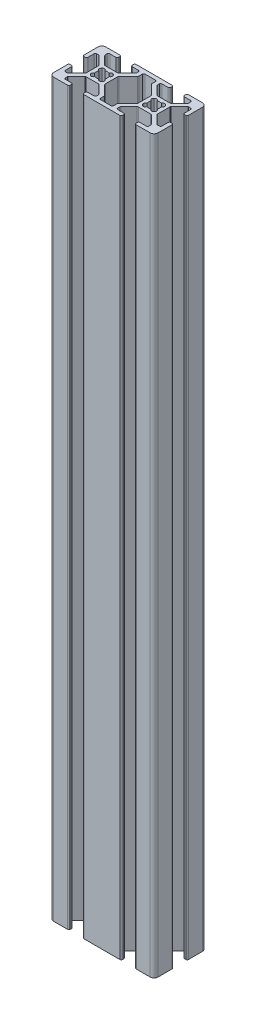
from build123d import *

# Parameters (mm, degrees)
EXTRUDE_1_DEPTH = 140


with BuildPart() as part:
    # 草图1 → 凸台-拉伸1 (new, symmetric)
    with BuildSketch(Plane(origin=(0, 0, 0), x_dir=(1, 0, 0), z_dir=(0, 1, 0))):
        with BuildLine():
            Line((-3.011929568, 5.856870214), (1.755909109, 5.856870214))
            ThreePointArc((1.755909109, 5.856870214), (1.950312292, 5.818201017), (2.115119353, 5.708080459))
            Line((2.115119353, 5.708080459), (5.218200015, 2.604999798))
            ThreePointArc((5.218200015, 2.604999798), (5.328320573, 2.440192737), (5.36698977, 2.245789553))
            Line((5.36698977, 2.245789553), (5.36698977, 1.519870214))
            ThreePointArc((5.36698977, 1.519870214), (5.218200015, 1.16065997), (4.85898977, 1.011870214))
            Line((4.85898977, 1.011870214), (2.50998977, 1.011870214))
            ThreePointArc((2.50998977, 1.011870214), (2.150779525, 0.863080459), (2.00198977, 0.503870214))
            Line((2.00198977, 0.503870214), (2.00198977, 0.019870214))
            ThreePointArc((2.00198977, 0.019870214), (2.150779525, -0.33934003), (2.50998977, -0.488129786))
            Line((2.50998977, -0.488129786), (16.23398977, -0.488129786))
            ThreePointArc((16.23398977, -0.488129786), (16.593200015, -0.33934003), (16.74198977, 0.019870214))
            Line((16.74198977, 0.019870214), (16.74198977, 0.503870214))
            ThreePointArc((16.74198977, 0.503870214), (16.593200015, 0.863080459), (16.23398977, 1.011870214))
            Line((16.23398977, 1.011870214), (13.88498977, 1.011870214))
            ThreePointArc((13.88498977, 1.011870214), (13.525779525, 1.16065997), (13.37698977, 1.519870214))
            Line((13.37698977, 1.519870214), (13.37698977, 2.245789553))
            ThreePointArc((13.37698977, 2.245789553), (13.415658968, 2.440192737), (13.525779525, 2.604999798))
            Line((13.525779525, 2.604999798), (16.628860187, 5.708080459))
            ThreePointArc((16.628860187, 5.708080459), (16.793667248, 5.818201017), (16.988070432, 5.856870214))
            Line((16.988070432, 5.856870214), (21.755909109, 5.856870214))
            ThreePointArc((21.755909109, 5.856870214), (21.950312292, 5.818201017), (22.115119353, 5.708080459))
            Line((22.115119353, 5.708080459), (25.218200015, 2.604999798))
            ThreePointArc((25.218200015, 2.604999798), (25.328320573, 2.440192737), (25.36698977, 2.245789553))
            Line((25.36698977, 2.245789553), (25.36698977, 1.519870214))
            ThreePointArc((25.36698977, 1.519870214), (25.218200015, 1.16065997), (24.85898977, 1.011870214))
            Line((24.85898977, 1.011870214), (22.50998977, 1.011870214))
            ThreePointArc((22.50998977, 1.011870214), (22.150779525, 0.863080459), (22.00198977, 0.503870214))
            Line((22.00198977, 0.503870214), (22.00198977, 0.019870214))
            ThreePointArc((22.00198977, 0.019870214), (22.150779525, -0.33934003), (22.50998977, -0.488129786))
            Line((22.50998977, -0.488129786), (27.87198977, -0.488129786))
            ThreePointArc((27.87198977, -0.488129786), (28.932649942, -0.048789957), (29.37198977, 1.011870214))
            Line((29.37198977, 1.011870214), (29.37198977, 6.373870214))
            ThreePointArc((29.37198977, 6.373870214), (29.223200015, 6.733080459), (28.86398977, 6.881870214))
            Line((28.86398977, 6.881870214), (28.37998977, 6.881870214))
            ThreePointArc((28.37998977, 6.881870214), (28.020779525, 6.733080459), (27.87198977, 6.373870214))
            Line((27.87198977, 6.373870214), (27.87198977, 4.024870214))
            ThreePointArc((27.87198977, 4.024870214), (27.723200015, 3.66565997), (27.36398977, 3.516870214))
            Line((27.36398977, 3.516870214), (26.638070432, 3.516870214))
            ThreePointArc((26.638070432, 3.516870214), (26.443667248, 3.555539412), (26.278860187, 3.66565997))
            Line((26.278860187, 3.66565997), (23.175779525, 6.768740631))
            ThreePointArc((23.175779525, 6.768740631), (23.065658968, 6.933547692), (23.02698977, 7.127950876))
            Line((23.02698977, 7.127950876), (23.02698977, 11.895789553))
            ThreePointArc((23.02698977, 11.895789553), (23.065658968, 12.090192737), (23.175779525, 12.254999798))
            Line((23.175779525, 12.254999798), (26.278860187, 15.358080459))
            ThreePointArc((26.278860187, 15.358080459), (26.443667248, 15.468201017), (26.638070432, 15.506870214))
            Line((26.638070432, 15.506870214), (27.36398977, 15.506870214))
            ThreePointArc((27.36398977, 15.506870214), (27.723200015, 15.358080459), (27.87198977, 14.998870214))
            Line((27.87198977, 14.998870214), (27.87198977, 12.649870214))
            ThreePointArc((27.87198977, 12.649870214), (28.020779525, 12.29065997), (28.37998977, 12.141870214))
            Line((28.37998977, 12.141870214), (28.86398977, 12.141870214))
            ThreePointArc((28.86398977, 12.141870214), (29.223200015, 12.29065997), (29.37198977, 12.649870214))
            Line((29.37198977, 12.649870214), (29.37198977, 18.011870214))
            ThreePointArc((29.37198977, 18.011870214), (28.932649942, 19.072530386), (27.87198977, 19.511870214))
            Line((27.87198977, 19.511870214), (22.50998977, 19.511870214))
            ThreePointArc((22.50998977, 19.511870214), (22.150779525, 19.363080459), (22.00198977, 19.003870214))
            Line((22.00198977, 19.003870214), (22.00198977, 18.519870214))
            ThreePointArc((22.00198977, 18.519870214), (22.150779525, 18.16065997), (22.50998977, 18.011870214))
            Line((22.50998977, 18.011870214), (24.85898977, 18.011870214))
            ThreePointArc((24.85898977, 18.011870214), (25.218200015, 17.863080459), (25.36698977, 17.503870214))
            Line((25.36698977, 17.503870214), (25.36698977, 16.777950876))
            ThreePointArc((25.36698977, 16.777950876), (25.328320573, 16.583547692), (25.218200015, 16.418740631))
            Line((25.218200015, 16.418740631), (22.115119353, 13.31565997))
            ThreePointArc((22.115119353, 13.31565997), (21.950312292, 13.205539412), (21.755909109, 13.166870214))
            Line((21.755909109, 13.166870214), (16.988070432, 13.166870214))
            ThreePointArc((16.988070432, 13.166870214), (16.793667248, 13.205539412), (16.628860187, 13.31565997))
            Line((16.628860187, 13.31565997), (13.525779525, 16.418740631))
            ThreePointArc((13.525779525, 16.418740631), (13.415658968, 16.583547692), (13.37698977, 16.777950876))
            Line((13.37698977, 16.777950876), (13.37698977, 17.503870214))
            ThreePointArc((13.37698977, 17.503870214), (13.525779525, 17.863080459), (13.88498977, 18.011870214))
            Line((13.88498977, 18.011870214), (16.23398977, 18.011870214))
            ThreePointArc((16.23398977, 18.011870214), (16.593200015, 18.16065997), (16.74198977, 18.519870214))
            Line((16.74198977, 18.519870214), (16.74198977, 19.003870214))
            ThreePointArc((16.74198977, 19.003870214), (16.593200015, 19.363080459), (16.23398977, 19.511870214))
            Line((16.23398977, 19.511870214), (2.50998977, 19.511870214))
            ThreePointArc((2.50998977, 19.511870214), (2.150779525, 19.363080459), (2.00198977, 19.003870214))
            Line((2.00198977, 19.003870214), (2.00198977, 18.519870214))
            ThreePointArc((2.00198977, 18.519870214), (2.150779525, 18.16065997), (2.50998977, 18.011870214))
            Line((2.50998977, 18.011870214), (4.85898977, 18.011870214))
            ThreePointArc((4.85898977, 18.011870214), (5.218200015, 17.863080459), (5.36698977, 17.503870214))
            Line((5.36698977, 17.503870214), (5.36698977, 16.777950876))
            ThreePointArc((5.36698977, 16.777950876), (5.328320573, 16.583547692), (5.218200015, 16.418740631))
            Line((5.218200015, 16.418740631), (2.115119353, 13.31565997))
            ThreePointArc((2.115119353, 13.31565997), (1.950312292, 13.205539412), (1.755909109, 13.166870214))
            Line((1.755909109, 13.166870214), (-3.011929568, 13.166870214))
            ThreePointArc((-3.011929568, 13.166870214), (-3.206332752, 13.205539412), (-3.371139813, 13.31565997))
            Line((-3.371139813, 13.31565997), (-6.474220475, 16.418740631))
            ThreePointArc((-6.474220475, 16.418740631), (-6.584341032, 16.583547692), (-6.62301023, 16.777950876))
            Line((-6.62301023, 16.777950876), (-6.62301023, 17.503870214))
            ThreePointArc((-6.62301023, 17.503870214), (-6.474220475, 17.863080459), (-6.11501023, 18.011870214))
            Line((-6.11501023, 18.011870214), (-3.76601023, 18.011870214))
            ThreePointArc((-3.76601023, 18.011870214), (-3.406799985, 18.16065997), (-3.25801023, 18.519870214))
            Line((-3.25801023, 18.519870214), (-3.25801023, 19.003870214))
            ThreePointArc((-3.25801023, 19.003870214), (-3.406799985, 19.363080459), (-3.76601023, 19.511870214))
            Line((-3.76601023, 19.511870214), (-9.12801023, 19.511870214))
            ThreePointArc((-9.12801023, 19.511870214), (-10.188670402, 19.072530386), (-10.62801023, 18.011870214))
            Line((-10.62801023, 18.011870214), (-10.62801023, 12.649870214))
            ThreePointArc((-10.62801023, 12.649870214), (-10.479220475, 12.29065997), (-10.12001023, 12.141870214))
            Line((-10.12001023, 12.141870214), (-9.63601023, 12.141870214))
            ThreePointArc((-9.63601023, 12.141870214), (-9.276799985, 12.29065997), (-9.12801023, 12.649870214))
            Line((-9.12801023, 12.649870214), (-9.12801023, 14.998870214))
            ThreePointArc((-9.12801023, 14.998870214), (-8.979220475, 15.358080459), (-8.62001023, 15.506870214))
            Line((-8.62001023, 15.506870214), (-7.894090891, 15.506870214))
            ThreePointArc((-7.894090891, 15.506870214), (-7.699687708, 15.468201017), (-7.534880647, 15.358080459))
            Line((-7.534880647, 15.358080459), (-4.431799985, 12.254999798))
            ThreePointArc((-4.431799985, 12.254999798), (-4.321679427, 12.090192737), (-4.28301023, 11.895789553))
            Line((-4.28301023, 11.895789553), (-4.28301023, 7.127950876))
            ThreePointArc((-4.28301023, 7.127950876), (-4.321679427, 6.933547692), (-4.431799985, 6.768740631))
            Line((-4.431799985, 6.768740631), (-7.534880647, 3.66565997))
            ThreePointArc((-7.534880647, 3.66565997), (-7.699687708, 3.555539412), (-7.894090891, 3.516870214))
            Line((-7.894090891, 3.516870214), (-8.62001023, 3.516870214))
            ThreePointArc((-8.62001023, 3.516870214), (-8.979220475, 3.66565997), (-9.12801023, 4.024870214))
            Line((-9.12801023, 4.024870214), (-9.12801023, 6.373870214))
            ThreePointArc((-9.12801023, 6.373870214), (-9.276799985, 6.733080459), (-9.63601023, 6.881870214))
            Line((-9.63601023, 6.881870214), (-10.12001023, 6.881870214))
            ThreePointArc((-10.12001023, 6.881870214), (-10.479220475, 6.733080459), (-10.62801023, 6.373870214))
            Line((-10.62801023, 6.373870214), (-10.62801023, 1.011870214))
            ThreePointArc((-10.62801023, 1.011870214), (-10.188670402, -0.048789957), (-9.12801023, -0.488129786))
            Line((-9.12801023, -0.488129786), (-3.76601023, -0.488129786))
            ThreePointArc((-3.76601023, -0.488129786), (-3.406799985, -0.33934003), (-3.25801023, 0.019870214))
            Line((-3.25801023, 0.019870214), (-3.25801023, 0.503870214))
            ThreePointArc((-3.25801023, 0.503870214), (-3.406799985, 0.863080459), (-3.76601023, 1.011870214))
            Line((-3.76601023, 1.011870214), (-6.11501023, 1.011870214))
            ThreePointArc((-6.11501023, 1.011870214), (-6.474220475, 1.16065997), (-6.62301023, 1.519870214))
            Line((-6.62301023, 1.519870214), (-6.62301023, 2.245789553))
            ThreePointArc((-6.62301023, 2.245789553), (-6.584341032, 2.440192737), (-6.474220475, 2.604999798))
            Line((-6.474220475, 2.604999798), (-3.371139813, 5.708080459))
            ThreePointArc((-3.371139813, 5.708080459), (-3.206332752, 5.818201017), (-3.011929568, 5.856870214))
        make_face()
        with BuildLine():
            Line((17.247088926, 7.207364248), (17.067483804, 7.386969371))
            ThreePointArc((17.067483804, 7.386969371), (16.866051753, 8.155402404), (17.436856264, 8.707893496))
            ThreePointArc((17.436856264, 8.707893496), (17.27648977, 9.511870214), (17.436856264, 10.315846932))
            ThreePointArc((17.436856264, 10.315846932), (16.866051753, 10.868338025), (17.067483804, 11.636771058))
            Line((17.067483804, 11.636771058), (17.247088926, 11.816376181))
            ThreePointArc((17.247088926, 11.816376181), (18.015521959, 12.017808231), (18.568013052, 11.447003721))
            ThreePointArc((18.568013052, 11.447003721), (19.37198977, 11.607370214), (20.175966488, 11.447003721))
            ThreePointArc((20.175966488, 11.447003721), (20.728457581, 12.017808231), (21.496890614, 11.816376181))
            Line((21.496890614, 11.816376181), (21.676495736, 11.636771058))
            ThreePointArc((21.676495736, 11.636771058), (21.877927787, 10.868338025), (21.307123276, 10.315846932))
            ThreePointArc((21.307123276, 10.315846932), (21.46748977, 9.511870214), (21.307123276, 8.707893496))
            ThreePointArc((21.307123276, 8.707893496), (21.877927787, 8.155402404), (21.676495736, 7.386969371))
            Line((21.676495736, 7.386969371), (21.496890614, 7.207364248))
            ThreePointArc((21.496890614, 7.207364248), (20.728457581, 7.005932198), (20.175966488, 7.576736708))
            ThreePointArc((20.175966488, 7.576736708), (19.37198977, 7.416370214), (18.568013052, 7.576736708))
            ThreePointArc((18.568013052, 7.576736708), (18.015521959, 7.005932198), (17.247088926, 7.207364248))
        make_face(mode=Mode.SUBTRACT)
        with BuildLine():
            Line((6.86698977, 1.519870214), (6.86698977, 2.867109897))
            ThreePointArc((6.86698977, 2.867109897), (6.828320573, 3.06151308), (6.718200015, 3.226320141))
            Line((6.718200015, 3.226320141), (3.175779525, 6.768740631))
            ThreePointArc((3.175779525, 6.768740631), (3.065658968, 6.933547692), (3.02698977, 7.127950876))
            Line((3.02698977, 7.127950876), (3.02698977, 11.895789553))
            ThreePointArc((3.02698977, 11.895789553), (3.065658968, 12.090192737), (3.175779525, 12.254999798))
            Line((3.175779525, 12.254999798), (6.718200015, 15.797420287))
            ThreePointArc((6.718200015, 15.797420287), (6.828320573, 15.962227349), (6.86698977, 16.156630532))
            Line((6.86698977, 16.156630532), (6.86698977, 17.503870214))
            ThreePointArc((6.86698977, 17.503870214), (7.015779525, 17.863080459), (7.37498977, 18.011870214))
            Line((7.37498977, 18.011870214), (11.36898977, 18.011870214))
            ThreePointArc((11.36898977, 18.011870214), (11.728200015, 17.863080459), (11.87698977, 17.503870214))
            Line((11.87698977, 17.503870214), (11.87698977, 16.156630532))
            ThreePointArc((11.87698977, 16.156630532), (11.915658968, 15.962227349), (12.025779525, 15.797420287))
            Line((12.025779525, 15.797420287), (15.568200015, 12.254999798))
            ThreePointArc((15.568200015, 12.254999798), (15.678320573, 12.090192737), (15.71698977, 11.895789553))
            Line((15.71698977, 11.895789553), (15.71698977, 7.127950876))
            ThreePointArc((15.71698977, 7.127950876), (15.678320573, 6.933547692), (15.568200015, 6.768740631))
            Line((15.568200015, 6.768740631), (12.025779525, 3.226320141))
            ThreePointArc((12.025779525, 3.226320141), (11.915658968, 3.06151308), (11.87698977, 2.867109897))
            Line((11.87698977, 2.867109897), (11.87698977, 1.519870214))
            ThreePointArc((11.87698977, 1.519870214), (11.728200015, 1.16065997), (11.36898977, 1.011870214))
            Line((11.36898977, 1.011870214), (7.37498977, 1.011870214))
            ThreePointArc((7.37498977, 1.011870214), (7.015779525, 1.16065997), (6.86698977, 1.519870214))
        make_face(mode=Mode.SUBTRACT)
        with BuildLine():
            Line((-2.752911074, 7.207364248), (-2.932516196, 7.386969371))
            ThreePointArc((-2.932516196, 7.386969371), (-3.133948247, 8.155402404), (-2.563143736, 8.707893496))
            ThreePointArc((-2.563143736, 8.707893496), (-2.72351023, 9.511870214), (-2.563143736, 10.315846932))
            ThreePointArc((-2.563143736, 10.315846932), (-3.133948247, 10.868338025), (-2.932516196, 11.636771058))
            Line((-2.932516196, 11.636771058), (-2.752911074, 11.816376181))
            ThreePointArc((-2.752911074, 11.816376181), (-1.984478041, 12.017808231), (-1.431986948, 11.447003721))
            ThreePointArc((-1.431986948, 11.447003721), (-0.62801023, 11.607370214), (0.175966488, 11.447003721))
            ThreePointArc((0.175966488, 11.447003721), (0.728457581, 12.017808231), (1.496890614, 11.816376181))
            Line((1.496890614, 11.816376181), (1.676495736, 11.636771058))
            ThreePointArc((1.676495736, 11.636771058), (1.877927787, 10.868338025), (1.307123276, 10.315846932))
            ThreePointArc((1.307123276, 10.315846932), (1.46748977, 9.511870214), (1.307123276, 8.707893496))
            ThreePointArc((1.307123276, 8.707893496), (1.877927787, 8.155402404), (1.676495736, 7.386969371))
            Line((1.676495736, 7.386969371), (1.496890614, 7.207364248))
            ThreePointArc((1.496890614, 7.207364248), (0.728457581, 7.005932198), (0.175966488, 7.576736708))
            ThreePointArc((0.175966488, 7.576736708), (-0.62801023, 7.416370214), (-1.431986948, 7.576736708))
            ThreePointArc((-1.431986948, 7.576736708), (-1.984478041, 7.005932198), (-2.752911074, 7.207364248))
        make_face(mode=Mode.SUBTRACT)
    extrude(amount=EXTRUDE_1_DEPTH, both=True)


solid = part.part
